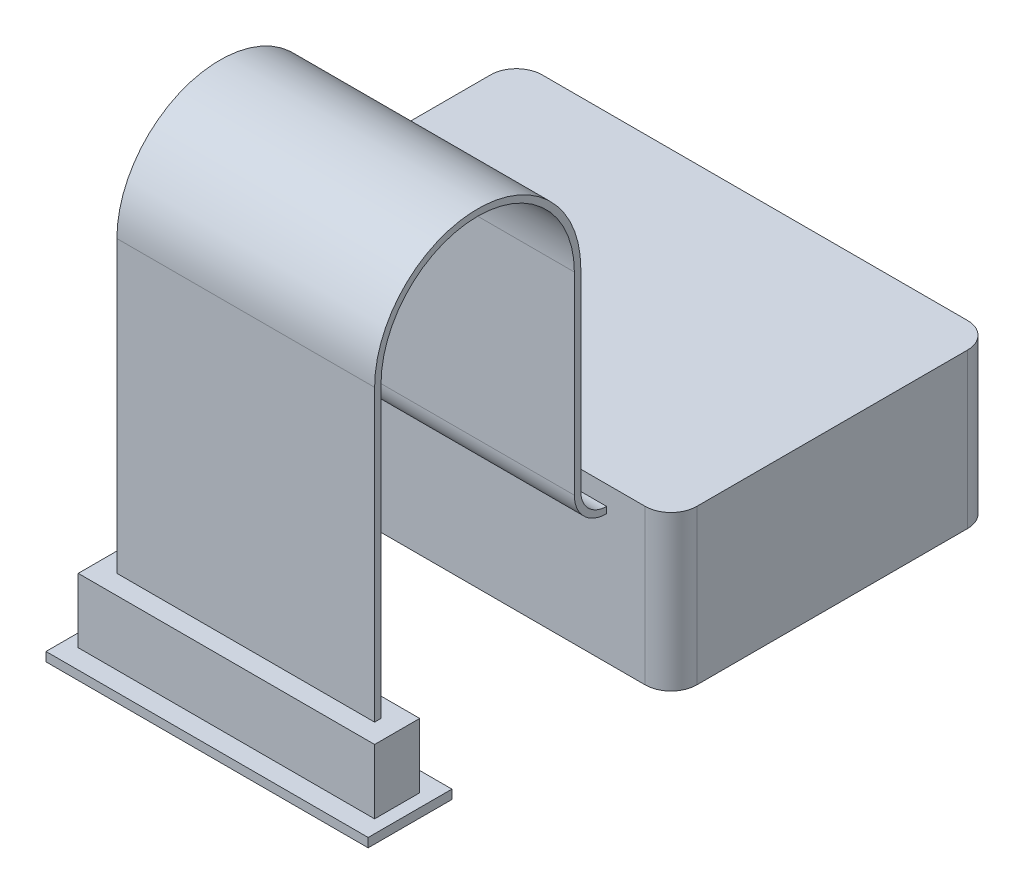
from build123d import *

# Parameters (mm, degrees)
SKETCH1_W           = 93.98
SKETCH1_H           = 63.5
BOSS_EXTRUDE1_DEPTH = 30.48
FILLET1_R           = 5.08
BOSS_EXTRUDE2_START = -12.7
BOSS_EXTRUDE2_DEPTH = 50.8
SKETCH4_W           = 63.5
SKETCH4_H           = 16.51
BOSS_EXTRUDE3_DEPTH = 1.778
SKETCH5_W           = 58.42
SKETCH5_H           = 8.89
BOSS_EXTRUDE4_DEPTH = 12.7


with BuildPart() as part:
    # Sketch1 → Boss-Extrude1 (new body)
    with BuildSketch(Plane(origin=(0, 0, 0), x_dir=(1, 0, 0), z_dir=(0, 1, 0))):
        Rectangle(SKETCH1_W, SKETCH1_H)
    extrude(amount=BOSS_EXTRUDE1_DEPTH)

    # Fillet1
    fillet1_edges = [part.edges().sort_by_distance(p)[0] for p in [
        (46.99, 15.24, 31.75),
        (-46.99, 15.24, 31.75),
        (-46.99, 15.24, -31.75),
        (46.99, 15.24, -31.75),
    ]]
    fillet(fillet1_edges, radius=FILLET1_R)

    # Sketch2 → Boss-Extrude2 (add)
    with BuildSketch(Plane(origin=(46.99, 0, 0), x_dir=(0, 0, -1), z_dir=(1, 0, 0)).offset(BOSS_EXTRUDE2_START)):
        with BuildLine():
            Line((-38.1, 31.75), (-38.1, 69.85))
            ThreePointArc((-38.1, 69.85), (-57.15, 88.9), (-76.2, 69.85))
            Line((-76.2, 69.85), (-76.2, 0))
            Line((-76.2, 0), (-77.47, 0))
            Line((-77.47, 0), (-77.47, 69.85))
            ThreePointArc((-77.47, 69.85), (-57.15, 90.17), (-36.83, 69.85))
            Line((-36.83, 69.85), (-36.83, 31.75))
            ThreePointArc((-36.83, 31.75), (-35.342102448, 28.157897552), (-31.75, 26.67))
            Line((-31.75, 26.67), (-31.75, 25.4))
            ThreePointArc((-31.75, 25.4), (-36.240128061, 27.259871939), (-38.1, 31.75))
        make_face()
    extrude(amount=-BOSS_EXTRUDE2_DEPTH)

    # Sketch4 → Boss-Extrude3 (add)
    with BuildSketch(Plane.XZ):
        with Locations((8.89, 76.835)):
            Rectangle(SKETCH4_W, SKETCH4_H)
    extrude(amount=BOSS_EXTRUDE3_DEPTH)

    # Sketch5 → Boss-Extrude4 (add)
    with BuildSketch(Plane(origin=(0, 0, 0), x_dir=(1, 0, 0), z_dir=(0, 1, 0))):
        with Locations((8.89, -76.835)):
            Rectangle(SKETCH5_W, SKETCH5_H)
    extrude(amount=BOSS_EXTRUDE4_DEPTH)


solid = part.part
